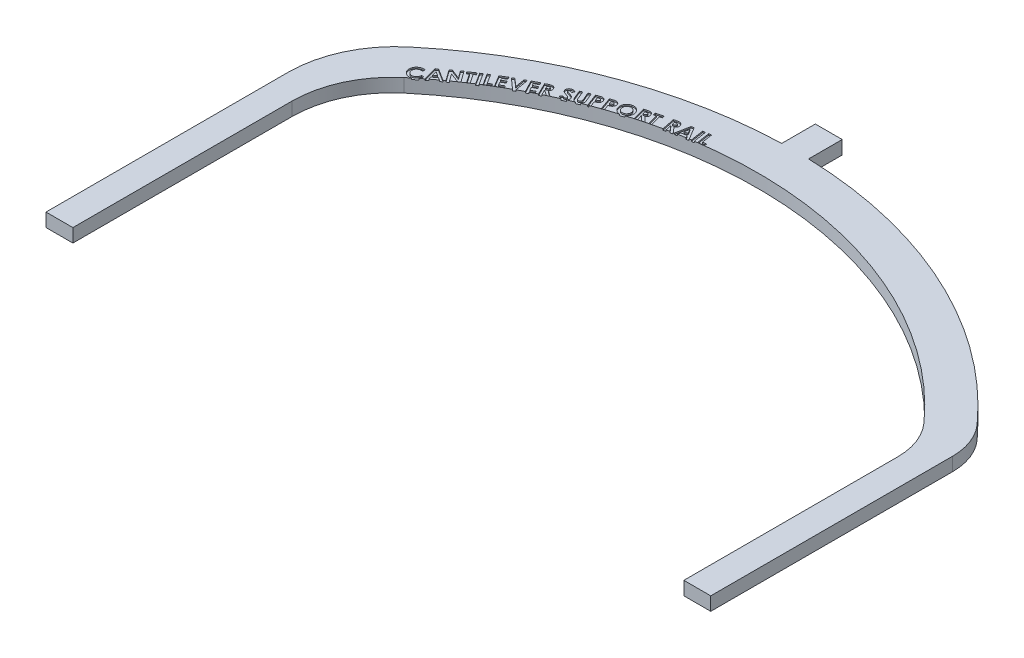
from build123d import *

# Parameters (mm, degrees)
BOSS_EXTRUDE1_DEPTH = 12.7
CUT_EXTRUDE1_DEPTH  = 1.27


with BuildPart() as part:
    # Sketch1 → Boss-Extrude1 (new body)
    with BuildSketch(Plane(origin=(0, 0, 0), x_dir=(1, 0, 0), z_dir=(0, 1, 0))):
        with BuildLine():
            Line((1550.835064837, 541.399098074), (1550.835064837, 573.149098074))
            Line((1550.835064837, 573.149098074), (1576.235064837, 573.149098074))
            Line((1576.235064837, 573.149098074), (1576.235064837, 541.399098074))
            ThreePointArc((1576.235064837, 541.399098074), (1738.74727729, 502.951930692), (1873.099473338, 403.765786028))
            ThreePointArc((1873.099473338, 403.765786028), (1883.76055811, 386.368476855), (1887.478900163, 366.306098448))
            Line((1887.478900163, 366.306098448), (1887.478900163, 137.706098448))
            Line((1887.478900163, 137.706098448), (1862.078900163, 137.706098448))
            Line((1862.078900163, 137.706098448), (1862.078900163, 339.83839355))
            ThreePointArc((1862.078900163, 339.83839355), (1858.095187718, 361.332582469), (1846.673243344, 379.971501666))
            ThreePointArc((1846.673243344, 379.971501666), (1590.112281333, 505.104643792), (1318.632985546, 416.895673471))
            ThreePointArc((1318.632985546, 416.895673471), (1293.734950284, 384.447922183), (1284.88267929, 344.517908135))
            Line((1284.88267929, 344.517908135), (1284.88267929, 137.706098448))
            Line((1284.88267929, 137.706098448), (1259.48267929, 137.706098448))
            Line((1259.48267929, 137.706098448), (1259.48267929, 366.306098448))
            ThreePointArc((1259.48267929, 366.306098448), (1269.001808127, 409.244113841), (1295.775458146, 444.136213869))
            ThreePointArc((1295.775458146, 444.136213869), (1415.111970585, 514.253524637), (1550.835064837, 541.399098074))
        make_face()
    extrude(amount=BOSS_EXTRUDE1_DEPTH)

    # Sketch2 → Cut-Extrude1 (cut)
    # profile 1 of 21: a face of its own
    with BuildSketch(Plane(origin=(0, 12.7, 0), x_dir=(1, 0, 0), z_dir=(0, 1, 0))):
        with BuildLine():
            Line((1322.301535226, 433.121755202), (1321.993702694, 430.824459529))
            add(Edge.make_bspline(
                [(1321.993702694, 430.824459529), (1321.792990552, 430.847773678), (1321.400083745, 430.89341261), (1320.818242651, 430.89612055), (1320.260830167, 430.85292004), (1319.728977648, 430.75277216), (1319.220926124, 430.602735401), (1318.738092919, 430.397836404), (1318.278760454, 430.141180913), (1317.998141673, 429.930547954), (1317.85704404, 429.824639817)],
                knots=[0, 0, 0, 0, 1.106407058, 2.165862322, 3.182258357, 4.165583983, 5.125578408, 6.079209504, 7.034209356, 8, 8, 8, 8], degree=3))
            add(Edge.make_bspline(
                [(1317.85704404, 429.824639817), (1317.743965978, 429.73013211), (1317.521269325, 429.544008031), (1317.22562581, 429.230941539), (1316.967177613, 428.899637239), (1316.747949915, 428.548562256), (1316.561652543, 428.181190217), (1316.421154369, 427.79163944), (1316.311699497, 427.385311391), (1316.248598124, 426.963675802), (1316.219620434, 426.53815035), (1316.231038252, 426.117745058), (1316.288480849, 425.707072825), (1316.384512632, 425.30699407), (1316.523996334, 424.917049487), (1316.702303909, 424.53769249), (1316.922351978, 424.167215228), (1317.098240031, 423.936015219), (1317.187953495, 423.818089337)],
                knots=[0, 0, 0, 0, 1.048666614, 2.065250675, 3.059364313, 4.036160022, 5.008371787, 5.98656645, 6.979652465, 8.000264036, 9.016937772, 10.013780458, 10.989063043, 11.964513869, 12.938599237, 13.932712874, 14.945559482, 16, 16, 16, 16], degree=3))
            add(Edge.make_bspline(
                [(1317.187953495, 423.818089337), (1317.254016311, 423.738411227), (1317.384411131, 423.581142534), (1317.59375497, 423.362162999), (1317.811139712, 423.160947684), (1318.03349619, 422.974035635), (1318.267425532, 422.809344142), (1318.505619735, 422.656678565), (1318.756222211, 422.529359375), (1319.093110179, 422.375164028), (1319.531239611, 422.233904656), (1320.072338879, 422.139671168), (1320.624759231, 422.117339598), (1321.087541622, 422.169874975), (1321.457760247, 422.241904894), (1321.731457088, 422.319745658), (1322.00168896, 422.410750337), (1322.264150722, 422.523536789), (1322.523789793, 422.650156048), (1322.774192954, 422.799584807), (1323.023609765, 422.961156277), (1323.180970134, 423.084167693), (1323.260649809, 423.146454721)],
                knots=[0, 0, 0, 0, 0.906768496, 1.789780124, 2.652099966, 3.501743399, 4.332757296, 5.157467836, 5.978420216, 6.793296384, 8.403019627, 9.994891478, 11.593668778, 13.230014881, 14.063616269, 14.896554964, 15.721399407, 16.560546755, 17.39801439, 18.250642224, 19.114209881, 20, 20, 20, 20], degree=3))
            add(Edge.make_bspline(
                [(1323.260649809, 423.146454721), (1323.391302282, 423.256467327), (1323.64831446, 423.472877921), (1323.983203759, 423.83995676), (1324.274887798, 424.225912791), (1324.476940142, 424.571961286), (1324.615379816, 424.866843243), (1324.7123665, 425.105999767), (1324.798901797, 425.365376864), (1324.876325897, 425.64335919), (1324.948064336, 425.940255584), (1325.011621046, 426.254967983), (1325.064720917, 426.589516435), (1325.093077551, 426.819151174), (1325.107645001, 426.937119785)],
                knots=[0, 0, 0, 0, 1.413778581, 2.781105497, 4.106207901, 5.416079275, 6.091817327, 6.804184776, 7.552939064, 8.355902415, 9.194324103, 10.083077087, 11.015232911, 12, 12, 12, 12], degree=3))
            Line((1325.107645001, 426.937119785), (1327.43292545, 426.629287253))
            add(Edge.make_bspline(
                [(1327.43292545, 426.629287253), (1327.4119425, 426.472247341), (1327.370776739, 426.164155898), (1327.292382647, 425.715092515), (1327.199755711, 425.289536077), (1327.100139388, 424.886155993), (1326.982018182, 424.508301835), (1326.855716246, 424.151507992), (1326.713292463, 423.819956148), (1326.559414883, 423.507852892), (1326.388996585, 423.211636895), (1326.200447374, 422.923650613), (1325.99175344, 422.642833769), (1325.766934623, 422.366085286), (1325.522964313, 422.096256208), (1325.257018363, 421.835007883), (1324.974975982, 421.57714899), (1324.77595698, 421.413086646), (1324.675153014, 421.329988375)],
                knots=[0, 0, 0, 0, 1.235167176, 2.423233892, 3.552734985, 4.63032496, 5.661332412, 6.637994054, 7.579932953, 8.47289115, 9.349545907, 10.242602006, 11.155027255, 12.076106929, 13.021635592, 13.989394599, 14.98161987, 16, 16, 16, 16], degree=3))
            add(Edge.make_bspline(
                [(1324.675153014, 421.329988375), (1324.485168047, 421.184766882), (1324.112734762, 420.900084791), (1323.520200914, 420.541177739), (1322.920338532, 420.243530355), (1322.307334411, 420.015015992), (1321.684872862, 419.853924449), (1321.051305625, 419.75989097), (1320.407694973, 419.727977685), (1319.759101268, 419.767884232), (1319.118255184, 419.868503754), (1318.496044857, 420.030977002), (1317.90055608, 420.259460318), (1317.329487054, 420.548123723), (1316.785597248, 420.90181203), (1316.267956346, 421.317844984), (1315.770019137, 421.790328458), (1315.472319067, 422.14769013), (1315.320605739, 422.329808087)],
                knots=[0, 0, 0, 0, 1.086674333, 2.130240604, 3.14425077, 4.127665887, 5.099392052, 6.062457184, 7.035276795, 8.024112503, 9.011804752, 9.980772719, 10.942540086, 11.906531123, 12.885179544, 13.886655603, 14.923001557, 16, 16, 16, 16], degree=3))
            add(Edge.make_bspline(
                [(1315.320605739, 422.329808087), (1315.225920886, 422.452584773), (1315.039007108, 422.694953575), (1314.786137542, 423.072308549), (1314.565362348, 423.457414315), (1314.369864368, 423.847114719), (1314.20782429, 424.244957192), (1314.072030175, 424.648383185), (1313.964508501, 425.057894762), (1313.889000669, 425.473920106), (1313.83966441, 425.892833938), (1313.823016685, 426.31368732), (1313.83173687, 426.734575266), (1313.874883759, 427.154855224), (1313.938884646, 427.577168728), (1314.039649043, 427.998212284), (1314.168141016, 428.420010735), (1314.32084443, 428.839994198), (1314.505283944, 429.249626179), (1314.706951352, 429.648451525), (1314.937939382, 430.027845739), (1315.189378518, 430.392080425), (1315.464587183, 430.739808656), (1315.765909552, 431.066607237), (1316.08696256, 431.380469514), (1316.318194013, 431.572276114), (1316.434908623, 431.669090939)],
                knots=[0, 0, 0, 0, 1.063446131, 2.099308708, 3.113128256, 4.106972012, 5.08791094, 6.057415066, 7.025382015, 7.989565502, 8.955800203, 9.916555268, 10.876728927, 11.841122996, 12.812858676, 13.804861852, 14.807857841, 15.836704875, 16.868032467, 17.887942674, 18.900609878, 19.912424507, 20.922732836, 21.939801947, 22.960110272, 24, 24, 24, 24], degree=3))
            add(Edge.make_bspline(
                [(1316.434908623, 431.669090939), (1316.536608211, 431.748346862), (1316.739998582, 431.906851845), (1317.060241976, 432.121498196), (1317.391001963, 432.318536745), (1317.730018456, 432.49908371), (1318.080445135, 432.659248622), (1318.439660963, 432.803545748), (1318.81138064, 432.923082009), (1319.189166501, 433.031205195), (1319.572927533, 433.11792965), (1319.960464658, 433.180960431), (1320.348533035, 433.224237948), (1320.737431431, 433.247115863), (1321.12730916, 433.250595948), (1321.518678922, 433.228798006), (1321.911445352, 433.190145854), (1322.171174641, 433.144610052), (1322.301535226, 433.121755202)],
                knots=[0, 0, 0, 0, 0.992690894, 1.985295856, 2.966426479, 3.956794582, 4.941569963, 5.932368623, 6.936061861, 7.947058632, 8.957886643, 9.963893104, 10.969242217, 11.9636502, 12.962871673, 13.969958643, 14.981103055, 16, 16, 16, 16], degree=3))
        make_face()
    # profile 2 of 21: a face of its own
    with BuildSketch(Plane(origin=(0, 12.7, 0), x_dir=(1, 0, 0), z_dir=(0, 1, 0))):
        Polygon((1325.925495015, 438.718814565), (1327.866620817, 440.176566969), (1339.289497419, 433.025184757), (1337.300034278, 431.531815366), (1334.959489406, 433.012464405), (1330.855903669, 429.929050943), (1331.591140047, 427.242512482), (1329.601676906, 425.749143091), align=None)
        Polygon((1328.912233797, 436.790409116), (1330.16391649, 432.333197578), (1332.837734599, 434.340469212), align=None, mode=Mode.SUBTRACT)
    # profile 3 of 21: a face of its own
    with BuildSketch(Plane(origin=(0, 12.7, 0), x_dir=(1, 0, 0), z_dir=(0, 1, 0))):
        Polygon((1333.488387798, 444.467269589), (1335.363367766, 445.81053882), (1344.626328503, 442.197958691), (1339.777330106, 448.970274397), (1341.736264401, 450.372057249), (1349.103892606, 440.081292025), (1347.221280427, 438.732934653), (1337.981216324, 442.330250358), (1342.814950298, 435.578287217), (1340.856016003, 434.176504364), align=None)
    # profile 4 of 21: a face of its own
    with BuildSketch(Plane(origin=(0, 12.7, 0), x_dir=(1, 0, 0), z_dir=(0, 1, 0))):
        Polygon((1343.457262938, 451.318057438), (1349.209406368, 455.213029394), (1350.532323034, 453.26172731), (1348.636990502, 451.979515772), (1354.361149156, 443.523025387), (1352.351333451, 442.161947663), (1346.627174797, 450.618438047), (1344.780179605, 449.366755355), align=None)
    # profile 5 of 21: a face of its own
    with BuildSketch(Plane(origin=(0, 12.7, 0), x_dir=(1, 0, 0), z_dir=(0, 1, 0))):
        Polygon((1350.746765292, 456.165820244), (1352.756580997, 457.445487712), (1359.533984843, 446.803640757), (1357.524169138, 445.523973289), align=None)
    # profile 6 of 21: a face of its own
    with BuildSketch(Plane(origin=(0, 12.7, 0), x_dir=(1, 0, 0), z_dir=(0, 1, 0))):
        Polygon((1355.00829609, 458.885628585), (1357.033376218, 460.175472335), (1362.581994006, 451.464574899), (1365.533115801, 453.344643008), (1366.761901859, 451.413693489), (1361.785699936, 448.24378163), align=None)
    # profile 7 of 21: a face of its own
    with BuildSketch(Plane(origin=(0, 12.7, 0), x_dir=(1, 0, 0), z_dir=(0, 1, 0))):
        Polygon((1361.97326443, 463.070415371), (1367.847523244, 466.614305596), (1369.055956737, 464.609578031), (1365.214410263, 462.291929794), (1366.387226769, 460.348259922), (1370.228773244, 462.66590816), (1371.416854173, 460.696797583), (1367.575307699, 458.379149346), (1369.282379013, 455.550142935), (1373.123925487, 457.867791172), (1374.337447122, 455.855431397), (1368.463188308, 452.311541172), align=None)
    # profile 8 of 21: a face of its own
    with BuildSketch(Plane(origin=(0, 12.7, 0), x_dir=(1, 0, 0), z_dir=(0, 1, 0))):
        Polygon((1369.422659541, 467.394152944), (1371.574943195, 468.587322014), (1378.667811785, 462.308555989), (1377.141369477, 471.673279547), (1379.293653131, 472.866448617), (1381.425584221, 459.677987079), (1379.408136304, 458.558596053), align=None)
    # profile 9 of 21: a face of its own
    with BuildSketch(Plane(origin=(0, 12.7, 0), x_dir=(1, 0, 0), z_dir=(0, 1, 0))):
        Polygon((1381.397188685, 474.012984956), (1387.52585455, 477.200705308), (1388.612172659, 475.109479347), (1384.605261602, 473.025885597), (1385.663594935, 470.995717327), (1389.670505993, 473.079311077), (1390.739015608, 471.026246174), (1386.73210455, 468.942652424), (1388.26872314, 465.988986558), (1392.275634198, 468.072580308), (1393.367040448, 465.973722135), (1387.238374582, 462.786001783), align=None)
    # profile 10 of 21: a face of its own
    with BuildSketch(Plane(origin=(0, 12.7, 0), x_dir=(1, 0, 0), z_dir=(0, 1, 0))):
        with BuildLine():
            Line((1389.975096134, 478.316308835), (1392.264759595, 479.43315579))
            add(Edge.make_bspline(
                [(1392.264759595, 479.43315579), (1392.416136279, 479.50613655), (1392.707750929, 479.646727944), (1393.135338161, 479.835183399), (1393.535165892, 479.995962821), (1393.90606974, 480.130496821), (1394.246093579, 480.242459532), (1394.55916782, 480.321770213), (1394.842884963, 480.376131013), (1395.181650108, 480.415038813), (1395.584294484, 480.404175002), (1396.053607439, 480.32071452), (1396.50874792, 480.15664168), (1396.870215565, 479.961127893), (1397.149553623, 479.773955618), (1397.350120752, 479.613701171), (1397.538923183, 479.436857837), (1397.718194656, 479.245400818), (1397.886158107, 479.035931887), (1398.043519434, 478.809933535), (1398.189034294, 478.567298135), (1398.275689208, 478.397404264), (1398.319647416, 478.311220694)],
                knots=[0, 0, 0, 0, 1.422593538, 2.740508689, 3.954993647, 5.070073994, 6.080396258, 6.984084481, 7.802160152, 8.524404601, 9.867211116, 11.195119397, 12.543919373, 13.944275246, 14.663086207, 15.388499269, 16.114870863, 16.851389181, 17.607076929, 18.385773865, 19.181137187, 20, 20, 20, 20], degree=3))
            add(Edge.make_bspline(
                [(1398.319647416, 478.311220694), (1398.362326146, 478.219274653), (1398.446259846, 478.038449888), (1398.550811757, 477.763337406), (1398.632858822, 477.49050153), (1398.691543291, 477.220841059), (1398.727768408, 476.954585959), (1398.740868362, 476.691532431), (1398.729956467, 476.432058223), (1398.700125718, 476.175682817), (1398.645995989, 475.922920362), (1398.570079172, 475.673213131), (1398.468874489, 475.428384728), (1398.350036122, 475.184505801), (1398.203037944, 474.946613579), (1398.037759866, 474.70801277), (1397.847050879, 474.47503157), (1397.706603269, 474.326367036), (1397.635292448, 474.250884155)],
                knots=[0, 0, 0, 0, 1.096487852, 2.156396899, 3.181092263, 4.176280596, 5.139094629, 6.085239497, 7.02181581, 7.945905086, 8.874447392, 9.814791195, 10.765507159, 11.737977847, 12.746609604, 13.787646357, 14.876700308, 16, 16, 16, 16], degree=3))
            Line((1397.635292448, 474.250884155), (1402.779403025, 470.518732713))
            Line((1402.779403025, 470.518732713), (1400.421049659, 469.366268771))
            Line((1400.421049659, 469.366268771), (1395.523713922, 472.925423418))
            Line((1395.523713922, 472.925423418), (1395.325276422, 472.828748739))
            Line((1395.325276422, 472.828748739), (1397.668365364, 468.02554361))
            Line((1397.668365364, 468.02554361), (1395.508449499, 466.972298418))
            Line((1395.508449499, 466.972298418), (1389.975096134, 478.316308835))
        make_face()
        with BuildLine():
            Line((1394.297471935, 474.935239123), (1394.974194691, 475.263424219))
            add(Edge.make_bspline(
                [(1394.974194691, 475.263424219), (1395.056843812, 475.304215218), (1395.215431232, 475.382485129), (1395.437849655, 475.507467316), (1395.634903077, 475.632903093), (1395.812201214, 475.749819839), (1395.9611732, 475.870945586), (1396.085993831, 475.990303931), (1396.189241695, 476.106513323), (1396.292483703, 476.259555675), (1396.372367914, 476.467149427), (1396.398694085, 476.737934328), (1396.345046167, 477.027256363), (1396.263893793, 477.214493153), (1396.220789243, 477.313945053)],
                knots=[0, 0, 0, 0, 1.200426863, 2.303383239, 3.320888538, 4.243092844, 5.067715529, 5.817715453, 6.491077461, 7.088489117, 8.214654342, 9.346763004, 10.590717892, 12, 12, 12, 12], degree=3))
            add(Edge.make_bspline(
                [(1396.220789243, 477.313945053), (1396.189499441, 477.372723006), (1396.128661363, 477.487007453), (1396.00881988, 477.637315544), (1395.870136406, 477.763015427), (1395.715152322, 477.864400354), (1395.548685201, 477.940772383), (1395.374294633, 477.994127256), (1395.19089965, 478.012162493), (1395.032771587, 478.009269053), (1394.896095713, 477.988519936), (1394.778426524, 477.959514699), (1394.644297171, 477.922132619), (1394.497218416, 477.86611044), (1394.333057476, 477.803820913), (1394.15327044, 477.730019377), (1393.961183247, 477.639722119), (1393.82763295, 477.576048988), (1393.758128986, 477.542911399)],
                knots=[0, 0, 0, 0, 1.12930227, 2.195749908, 3.246217328, 4.29707981, 5.328406346, 6.349519975, 7.378832199, 8.445279837, 9.027974321, 9.723362363, 10.503028987, 11.39167048, 12.394945795, 13.486494279, 14.691889031, 16, 16, 16, 16], degree=3))
            Line((1393.758128986, 477.542911399), (1393.165360557, 477.255431431))
            Line((1393.165360557, 477.255431431), (1394.297471935, 474.935239123))
        make_face(mode=Mode.SUBTRACT)
    # profile 11 of 21: a face of its own
    with BuildSketch(Plane(origin=(0, 12.7, 0), x_dir=(1, 0, 0), z_dir=(0, 1, 0))):
        with BuildLine():
            Line((1410.994001857, 485.960754985), (1409.958565158, 483.816103543))
            add(Edge.make_bspline(
                [(1409.958565158, 483.816103543), (1409.847681443, 483.882479693), (1409.63520242, 484.009671856), (1409.311704032, 484.162643239), (1409.005098042, 484.280662367), (1408.712477188, 484.36333698), (1408.433369424, 484.40079929), (1408.168826617, 484.406200043), (1407.91827672, 484.368666312), (1407.763193326, 484.313810206), (1407.68671019, 484.286756588)],
                knots=[0, 0, 0, 0, 1.2878694, 2.467857736, 3.562383444, 4.561287718, 5.49159874, 6.362533299, 7.192443595, 8, 8, 8, 8], degree=3))
            add(Edge.make_bspline(
                [(1407.68671019, 484.286756588), (1407.617697362, 484.255007455), (1407.485090607, 484.194002139), (1407.310795865, 484.070080216), (1407.171160761, 483.922365207), (1407.064886001, 483.758110078), (1406.994145851, 483.587767986), (1406.958238484, 483.41952022), (1406.960804494, 483.256024813), (1406.995440537, 483.155775399), (1407.012531504, 483.10630787)],
                knots=[0, 0, 0, 0, 1.210634971, 2.326210629, 3.388969557, 4.436448685, 5.431823306, 6.315773386, 7.168927529, 8, 8, 8, 8], degree=3))
            add(Edge.make_bspline(
                [(1407.012531504, 483.10630787), (1407.035401652, 483.058618854), (1407.081079748, 482.963370523), (1407.181740174, 482.837781219), (1407.301354726, 482.723600212), (1407.396344102, 482.663771361), (1407.445023491, 482.633110754)],
                knots=[0, 0, 0, 0, 0.970598421, 1.938557122, 2.943568372, 4, 4, 4, 4], degree=3))
            add(Edge.make_bspline(
                [(1407.445023491, 482.633110754), (1407.48727271, 482.611602545), (1407.585003374, 482.561849871), (1407.755805956, 482.485435358), (1407.9729697, 482.403972215), (1408.232969216, 482.306378277), (1408.537362954, 482.197584542), (1408.886712229, 482.077819868), (1409.280421805, 481.948677464), (1409.558224138, 481.860330244), (1409.704158107, 481.813920049)],
                knots=[0, 0, 0, 0, 0.473039196, 1.094231703, 1.86580489, 2.786879137, 3.865541278, 5.091156532, 6.471938417, 8, 8, 8, 8], degree=3))
            add(Edge.make_bspline(
                [(1409.704158107, 481.813920049), (1409.840697651, 481.77154339), (1410.099426851, 481.69124373), (1410.466894638, 481.576783705), (1410.79197947, 481.473320791), (1411.074680341, 481.378381544), (1411.316345248, 481.296898495), (1411.51716131, 481.229326336), (1411.676077159, 481.171397082), (1411.766661316, 481.133233218), (1411.80556035, 481.116844729)],
                knots=[0, 0, 0, 0, 1.549332474, 2.935834844, 4.171053748, 5.246346381, 6.167615194, 6.934873036, 7.542608647, 8, 8, 8, 8], degree=3))
            add(Edge.make_bspline(
                [(1411.80556035, 481.116844729), (1411.95828367, 481.049279853), (1412.251225888, 480.919682064), (1412.658092476, 480.701826883), (1413.011245548, 480.468076978), (1413.315265549, 480.21764167), (1413.577501414, 479.944741982), (1413.806505555, 479.64596553), (1414.007599364, 479.319016517), (1414.113044456, 479.083740439), (1414.166457786, 478.964561075)],
                knots=[0, 0, 0, 0, 1.218593649, 2.33741335, 3.36393597, 4.304581952, 5.206304846, 6.119908159, 7.047637353, 8, 8, 8, 8], degree=3))
            add(Edge.make_bspline(
                [(1414.166457786, 478.964561075), (1414.212951264, 478.845811761), (1414.304244004, 478.612640344), (1414.398139737, 478.254225807), (1414.454020013, 477.898820437), (1414.476659788, 477.545818449), (1414.454441213, 477.19615438), (1414.398594591, 476.848993275), (1414.303641348, 476.504514118), (1414.171367845, 476.16578431), (1414.007460446, 475.838683183), (1413.810067237, 475.530464933), (1413.579442767, 475.245103985), (1413.319501011, 474.979210158), (1413.026810445, 474.737144439), (1412.705025746, 474.514454876), (1412.349940462, 474.315790528), (1412.097388068, 474.203467604), (1411.968380863, 474.146091524)],
                knots=[0, 0, 0, 0, 1.029556458, 2.021595992, 2.985708114, 3.932703223, 4.872859116, 5.809914817, 6.768877421, 7.753580461, 8.74318054, 9.719963619, 10.704285286, 11.702244539, 12.718864513, 13.767839756, 14.859782129, 16, 16, 16, 16], degree=3))
            add(Edge.make_bspline(
                [(1411.968380863, 474.146091524), (1411.865517533, 474.104559295), (1411.663102866, 474.022832092), (1411.352528068, 473.93044914), (1411.045713596, 473.854605592), (1410.739190382, 473.806922159), (1410.435722129, 473.781299803), (1410.134467212, 473.777441713), (1409.835407098, 473.802608993), (1409.537214746, 473.843872637), (1409.239679857, 473.914272434), (1408.942035115, 474.008527317), (1408.642279374, 474.128533349), (1408.344357676, 474.277915107), (1408.041420969, 474.444768774), (1407.742012683, 474.642427305), (1407.440579495, 474.864142944), (1407.244912493, 475.026992167), (1407.144823171, 475.110294248)],
                knots=[0, 0, 0, 0, 1.019512359, 2.006198468, 2.976478022, 3.923895165, 4.855128123, 5.775325414, 6.690386988, 7.612333799, 8.54108207, 9.49798304, 10.481211848, 11.506523105, 12.560840675, 13.65958443, 14.802809837, 16, 16, 16, 16], degree=3))
            Line((1407.144823171, 475.110294248), (1408.544061953, 477.020891203))
            add(Edge.make_bspline(
                [(1408.544061953, 477.020891203), (1408.664684827, 476.928038939), (1408.895562706, 476.750315318), (1409.250732163, 476.528419247), (1409.592359417, 476.353108528), (1409.924898528, 476.236863821), (1410.244076527, 476.161536896), (1410.552855585, 476.151553256), (1410.851558008, 476.182206192), (1411.036521715, 476.249516167), (1411.128837594, 476.283110754)],
                knots=[0, 0, 0, 0, 1.293695427, 2.476194169, 3.556545698, 4.550954296, 5.466090318, 6.332180663, 7.167586921, 8, 8, 8, 8], degree=3))
            add(Edge.make_bspline(
                [(1411.128837594, 476.283110754), (1411.219765858, 476.324749444), (1411.395733035, 476.40532992), (1411.623655781, 476.578695982), (1411.812661421, 476.781232008), (1411.955290506, 477.012273688), (1412.056299701, 477.252587997), (1412.101156691, 477.495300901), (1412.094361885, 477.732631362), (1412.044243305, 477.879043541), (1412.019262273, 477.952021011)],
                knots=[0, 0, 0, 0, 1.144243178, 2.214374637, 3.260806911, 4.305428748, 5.313487681, 6.233226722, 7.11937213, 8, 8, 8, 8], degree=3))
            add(Edge.make_bspline(
                [(1412.019262273, 477.952021011), (1411.987758924, 478.017104338), (1411.923552018, 478.149750525), (1411.778340184, 478.325518028), (1411.600906722, 478.487077051), (1411.423735123, 478.606989991), (1411.255775099, 478.700962812), (1411.099073476, 478.775633998), (1410.915051499, 478.854892375), (1410.703073466, 478.935337628), (1410.463870612, 479.021747942), (1410.197041421, 479.113530909), (1409.901795228, 479.207474412), (1409.69494839, 479.268545492), (1409.587130863, 479.300378383)],
                knots=[0, 0, 0, 0, 0.905725074, 1.845956287, 2.841555597, 3.914441672, 4.525072941, 5.25899477, 6.094286937, 7.042155343, 8.107287944, 9.290058335, 10.587461091, 12, 12, 12, 12], degree=3))
            add(Edge.make_bspline(
                [(1409.587130863, 479.300378383), (1409.382616061, 479.362673654), (1408.989794935, 479.48232709), (1408.426560424, 479.661878023), (1407.914689273, 479.83916737), (1407.455647097, 480.015019005), (1407.046107633, 480.181364283), (1406.689830571, 480.346659653), (1406.383376507, 480.505789643), (1406.122686647, 480.663105882), (1405.898915968, 480.825170485), (1405.69819454, 480.991602456), (1405.51091523, 481.160264935), (1405.345318568, 481.340681905), (1405.194264022, 481.525746485), (1405.06177279, 481.719883137), (1404.946437833, 481.920528098), (1404.883722024, 482.060139164), (1404.852615639, 482.129384793)],
                knots=[0, 0, 0, 0, 1.800633136, 3.458560108, 4.978748589, 6.362272065, 7.598462714, 8.700915496, 9.668939887, 10.505575651, 11.26280371, 11.993494963, 12.701204515, 13.383480334, 14.053876462, 14.7115971, 15.360965638, 16, 16, 16, 16], degree=3))
            add(Edge.make_bspline(
                [(1404.852615639, 482.129384793), (1404.81429023, 482.230515557), (1404.738701358, 482.429974889), (1404.658637495, 482.737334289), (1404.615789891, 483.046406382), (1404.605570701, 483.356765091), (1404.627844582, 483.669230692), (1404.688703705, 483.982182064), (1404.776614583, 484.297522459), (1404.902982488, 484.607815964), (1405.052340642, 484.910678892), (1405.231192743, 485.194776099), (1405.436606798, 485.454906925), (1405.664033087, 485.696873181), (1405.918974, 485.91487465), (1406.197615625, 486.111245055), (1406.500374954, 486.286874039), (1406.716428811, 486.382533834), (1406.826814357, 486.43140803)],
                knots=[0, 0, 0, 0, 0.984956985, 1.942622148, 2.886756607, 3.822219336, 4.767459802, 5.734338717, 6.722472941, 7.745518332, 8.782187537, 9.796176267, 10.797813089, 11.798048164, 12.817175954, 13.848359334, 14.900690636, 16, 16, 16, 16], degree=3))
            add(Edge.make_bspline(
                [(1406.826814357, 486.43140803), (1406.973233198, 486.486677453), (1407.264527366, 486.596633662), (1407.722037133, 486.698587926), (1408.189499753, 486.740210414), (1408.586710875, 486.732284364), (1408.913513151, 486.696018349), (1409.173133966, 486.64615864), (1409.445589199, 486.579660957), (1409.731182091, 486.495745431), (1410.029658341, 486.390281181), (1410.340805451, 486.265671286), (1410.665441733, 486.123260676), (1410.882480277, 486.015913509), (1410.994001857, 485.960754985)],
                knots=[0, 0, 0, 0, 1.296358908, 2.57905188, 3.871228635, 5.179260446, 5.865619567, 6.595097192, 7.369284117, 8.190203814, 9.061853328, 9.99273808, 10.968602458, 12, 12, 12, 12], degree=3))
        make_face()
    # profile 12 of 21: a face of its own
    with BuildSketch(Plane(origin=(0, 12.7, 0), x_dir=(1, 0, 0), z_dir=(0, 1, 0))):
        with BuildLine():
            Line((1412.48438497, 488.58123768), (1414.71807888, 489.514911558))
            Line((1414.71807888, 489.514911558), (1417.885446669, 481.946301783))
            add(Edge.make_bspline(
                [(1417.885446669, 481.946301783), (1417.918920206, 481.868082428), (1417.98329556, 481.717653193), (1418.0834955, 481.503499819), (1418.178169761, 481.308150893), (1418.274149968, 481.134371248), (1418.362867261, 480.978277009), (1418.456874424, 480.846795398), (1418.541505633, 480.730053542), (1418.656195598, 480.605778297), (1418.810070041, 480.479751501), (1419.010395191, 480.356965678), (1419.233001951, 480.271328125), (1419.471587297, 480.213905323), (1419.724863066, 480.198221366), (1419.986273081, 480.214992288), (1420.254903012, 480.275601123), (1420.430260269, 480.342139969), (1420.52110372, 480.376610276)],
                knots=[0, 0, 0, 0, 1.153241552, 2.217881292, 3.204972048, 4.094904629, 4.909153226, 5.636204372, 6.284565251, 6.862216424, 7.923437174, 8.970302464, 10.03338948, 11.14318489, 12.284099347, 13.459417498, 14.683856679, 16, 16, 16, 16], degree=3))
            add(Edge.make_bspline(
                [(1420.52110372, 480.376610276), (1420.614925814, 480.418951336), (1420.798061154, 480.501598654), (1421.042435076, 480.665824704), (1421.25305997, 480.853815766), (1421.424698718, 481.065619744), (1421.564204876, 481.290328274), (1421.657002043, 481.526300246), (1421.717347458, 481.764840115), (1421.726585726, 481.971111685), (1421.713121317, 482.147222058), (1421.686311875, 482.301006775), (1421.64411847, 482.476151516), (1421.592303933, 482.674874686), (1421.518578769, 482.892508719), (1421.435686063, 483.133548607), (1421.332727466, 483.393747691), (1421.259047724, 483.574578263), (1421.220723111, 483.66863752)],
                knots=[0, 0, 0, 0, 1.266784692, 2.47269099, 3.612370752, 4.73383688, 5.821880848, 6.858298803, 7.846976863, 8.841274022, 9.386374246, 10.022133618, 10.762444203, 11.606715777, 12.552013388, 13.593268548, 14.748135506, 16, 16, 16, 16], degree=3))
            Line((1421.220723111, 483.66863752), (1418.167838496, 490.959943609))
            Line((1418.167838496, 490.959943609), (1420.401532406, 491.893617488))
            Line((1420.401532406, 491.893617488), (1423.319581284, 484.920320212))
            add(Edge.make_bspline(
                [(1423.319581284, 484.920320212), (1423.378904684, 484.779024113), (1423.492795775, 484.507759029), (1423.643865748, 484.112084683), (1423.780507912, 483.750312196), (1423.891887736, 483.417016017), (1423.987922494, 483.116843844), (1424.05759356, 482.846138463), (1424.114958385, 482.608660474), (1424.154289101, 482.330098474), (1424.172868801, 481.995221016), (1424.14199582, 481.590037356), (1424.068812425, 481.170830534), (1423.943185264, 480.747474971), (1423.781972933, 480.331781663), (1423.577860938, 479.941484735), (1423.331036727, 479.585788333), (1423.046840081, 479.259803381), (1422.718984433, 478.963418147), (1422.345141956, 478.697996607), (1421.92807774, 478.452843574), (1421.625877291, 478.318858973), (1421.470042021, 478.249767327)],
                knots=[0, 0, 0, 0, 1.154357555, 2.216175107, 3.190457693, 4.067242665, 4.863373573, 5.5637814, 6.172870319, 6.702306844, 7.681082269, 8.692908209, 9.756876047, 10.880997562, 12.013943226, 13.111278163, 14.190480593, 15.268036698, 16.362578625, 17.511460767, 18.71673856, 20, 20, 20, 20], degree=3))
            add(Edge.make_bspline(
                [(1421.470042021, 478.249767327), (1421.36542475, 478.207587981), (1421.15853305, 478.124173869), (1420.843470788, 478.026466854), (1420.531092151, 477.948636721), (1420.221525807, 477.895255996), (1419.914596293, 477.865373488), (1419.610214128, 477.853074069), (1419.308422607, 477.870206252), (1419.010766285, 477.904732199), (1418.722297504, 477.961730519), (1418.443858303, 478.031827526), (1418.179596046, 478.12095863), (1417.928432214, 478.226493542), (1417.688478399, 478.345227554), (1417.46223472, 478.482499472), (1417.250054886, 478.637246252), (1417.043707026, 478.807243234), (1416.843949657, 479.00993476), (1416.648614785, 479.256277026), (1416.445869898, 479.54160741), (1416.243470142, 479.8730247), (1416.033833199, 480.2434143), (1415.82796844, 480.661105665), (1415.609451612, 481.117011917), (1415.473141935, 481.440261006), (1415.402433848, 481.607940404)],
                knots=[0, 0, 0, 0, 1.018293376, 2.013782662, 2.975927212, 3.92397893, 4.847557232, 5.759408398, 6.671902528, 7.574314255, 8.463467738, 9.325323095, 10.165678633, 10.979225487, 11.784074931, 12.581309872, 13.36563988, 14.153997474, 14.993375366, 15.929881177, 16.990187904, 18.152659768, 19.435051747, 20.832411574, 22.356872952, 24, 24, 24, 24], degree=3))
            Line((1415.402433848, 481.607940404), (1412.48438497, 488.58123768))
        make_face()
    # profile 13 of 21: a face of its own
    with BuildSketch(Plane(origin=(0, 12.7, 0), x_dir=(1, 0, 0), z_dir=(0, 1, 0))):
        with BuildLine():
            Line((1423.372881719, 492.876702349), (1425.75921986, 493.790023664))
            add(Edge.make_bspline(
                [(1425.75921986, 493.790023664), (1425.914871558, 493.848763748), (1426.215304664, 493.962141669), (1426.65548329, 494.108566752), (1427.06573037, 494.234523009), (1427.445657259, 494.336537717), (1427.796770458, 494.415061813), (1428.118960572, 494.465725518), (1428.412000454, 494.494862987), (1428.679328856, 494.502082998), (1428.928185899, 494.481417665), (1429.168515982, 494.450431187), (1429.402283099, 494.396129426), (1429.630166792, 494.324508427), (1429.851462182, 494.235519661), (1430.067238587, 494.128273167), (1430.274602482, 493.999516427), (1430.479041569, 493.858784861), (1430.671599804, 493.697210881), (1430.856356602, 493.52223637), (1431.025992981, 493.327209663), (1431.186874254, 493.118988539), (1431.334695789, 492.894378373), (1431.468856627, 492.65382293), (1431.59552981, 492.399270755), (1431.666172866, 492.220060862), (1431.702168578, 492.128745619)],
                knots=[0, 0, 0, 0, 1.685466839, 3.253225273, 4.69921311, 6.033076036, 7.238094831, 8.34274807, 9.335357144, 10.220517108, 11.04755497, 11.862905841, 12.67371686, 13.475371053, 14.281112884, 15.088044949, 15.913250855, 16.752296914, 17.600487801, 18.45733834, 19.327865163, 20.216354999, 21.121922058, 22.049119932, 23.005941671, 24, 24, 24, 24], degree=3))
            add(Edge.make_bspline(
                [(1431.702168578, 492.128745619), (1431.739694824, 492.027587594), (1431.813517618, 491.828586395), (1431.889559054, 491.52530737), (1431.947788872, 491.229183811), (1431.978351585, 490.938032062), (1431.983821015, 490.651999677), (1431.963478715, 490.370961757), (1431.917630177, 490.094973572), (1431.845929787, 489.825324187), (1431.751713035, 489.563423912), (1431.637069479, 489.311921527), (1431.503780961, 489.069622361), (1431.34818218, 488.838634974), (1431.172111973, 488.616603278), (1430.975276829, 488.405243961), (1430.758922723, 488.203086523), (1430.601551617, 488.079978389), (1430.52171986, 488.01752767)],
                knots=[0, 0, 0, 0, 1.118195394, 2.199748614, 3.23817249, 4.246359182, 5.231573088, 6.201594864, 7.164573484, 8.128836504, 9.091413398, 10.047863274, 10.992676975, 11.956217731, 12.932835938, 13.928593038, 14.949209533, 16, 16, 16, 16], degree=3))
            add(Edge.make_bspline(
                [(1430.52171986, 488.01752767), (1430.467877164, 487.979565253), (1430.350902117, 487.89709064), (1430.151796393, 487.778542129), (1429.915946917, 487.655229786), (1429.647373283, 487.519599474), (1429.342158837, 487.380934815), (1429.00126379, 487.236071062), (1428.626478346, 487.080227656), (1428.36206929, 486.978880403), (1428.224424187, 486.92612142)],
                knots=[0, 0, 0, 0, 0.620038409, 1.347054058, 2.179206309, 3.12533192, 4.179171049, 5.334366645, 6.612334305, 8, 8, 8, 8], degree=3))
            Line((1428.224424187, 486.92612142), (1430.135021142, 481.924478792))
            Line((1430.135021142, 481.924478792), (1427.886062809, 481.064582958))
            Line((1427.886062809, 481.064582958), (1423.372881719, 492.876702349))
        make_face()
        with BuildLine():
            Line((1427.387424988, 489.119110202), (1428.102308802, 489.391325747))
            add(Edge.make_bspline(
                [(1428.102308802, 489.391325747), (1428.231791399, 489.442524998), (1428.469251411, 489.536420047), (1428.786226805, 489.683974102), (1429.035162606, 489.818129538), (1429.222025134, 489.949579136), (1429.358540092, 490.086233416), (1429.463695073, 490.229709175), (1429.545175469, 490.385410672), (1429.597428583, 490.554351035), (1429.626690306, 490.732602248), (1429.623185616, 490.918351922), (1429.589534408, 491.10864637), (1429.546563373, 491.232883854), (1429.524444219, 491.296834561)],
                knots=[0, 0, 0, 0, 1.835359118, 3.365891694, 4.607118792, 5.559818435, 6.366204397, 7.142176498, 7.89724755, 8.671607073, 9.463840012, 10.26890727, 11.108927524, 12, 12, 12, 12], degree=3))
            add(Edge.make_bspline(
                [(1429.524444219, 491.296834561), (1429.502178443, 491.351840165), (1429.459194979, 491.45802696), (1429.372225526, 491.601230987), (1429.280128683, 491.73041904), (1429.170326823, 491.838353267), (1429.050555297, 491.930975913), (1428.917236846, 492.005834194), (1428.77054245, 492.058657221), (1428.668226704, 492.081510432), (1428.616211046, 492.093128632)],
                knots=[0, 0, 0, 0, 1.120489056, 2.163073078, 3.160766418, 4.11347921, 5.063081425, 6.018086827, 6.992427632, 8, 8, 8, 8], degree=3))
            add(Edge.make_bspline(
                [(1428.616211046, 492.093128632), (1428.573875714, 492.098168774), (1428.483517619, 492.108926163), (1428.337477677, 492.108644589), (1428.17463518, 492.088041742), (1427.993037314, 492.059158079), (1427.79463967, 492.007446903), (1427.57616048, 491.948963092), (1427.342397967, 491.867548655), (1427.181258368, 491.808429587), (1427.09740095, 491.777663888)],
                knots=[0, 0, 0, 0, 0.652982017, 1.393687203, 2.230315977, 3.166033818, 4.209268437, 5.369525377, 6.631094959, 8, 8, 8, 8], degree=3))
            Line((1427.09740095, 491.777663888), (1426.463927392, 491.535977189))
            Line((1426.463927392, 491.535977189), (1427.387424988, 489.119110202))
        make_face(mode=Mode.SUBTRACT)
    # profile 14 of 21: a face of its own
    with BuildSketch(Plane(origin=(0, 12.7, 0), x_dir=(1, 0, 0), z_dir=(0, 1, 0))):
        with BuildLine():
            Line((1432.965385719, 496.412862376), (1435.374620495, 497.270214139))
            add(Edge.make_bspline(
                [(1435.374620495, 497.270214139), (1435.532095777, 497.325238164), (1435.835664408, 497.43130921), (1436.278752543, 497.572583905), (1436.693217671, 497.686719158), (1437.076674176, 497.778768686), (1437.429561016, 497.849019536), (1437.753087309, 497.895298088), (1438.047116005, 497.920422924), (1438.315293197, 497.917767716), (1438.564361232, 497.893966552), (1438.803467685, 497.853741153), (1439.036428331, 497.794605725), (1439.262913876, 497.718621238), (1439.482318352, 497.623978457), (1439.695533531, 497.511604892), (1439.900318179, 497.377842624), (1440.102123979, 497.231833888), (1440.292211016, 497.066162861), (1440.471029235, 496.885187026), (1440.636510008, 496.687785808), (1440.792094011, 496.476801341), (1440.935451464, 496.249181386), (1441.063738019, 496.005198025), (1441.182404588, 495.746318078), (1441.249979479, 495.56613613), (1441.284496296, 495.474100357)],
                knots=[0, 0, 0, 0, 1.688087123, 3.254163378, 4.705344846, 6.037533579, 7.24429259, 8.345088523, 9.343582574, 10.227561597, 11.055038124, 11.873340818, 12.678853202, 13.484868302, 14.288320841, 15.09451867, 15.920569895, 16.761641462, 17.613372322, 18.469028527, 19.333802971, 20.217781994, 21.120189964, 22.053095962, 23.005534013, 24, 24, 24, 24], degree=3))
            add(Edge.make_bspline(
                [(1441.284496296, 495.474100357), (1441.319101529, 495.371102184), (1441.386799159, 495.169608604), (1441.460606819, 494.865004536), (1441.509383011, 494.56735931), (1441.533202226, 494.27457465), (1441.529635117, 493.987849797), (1441.506126175, 493.705585858), (1441.450989719, 493.431010267), (1441.375033407, 493.162743094), (1441.275191609, 492.90360126), (1441.15629531, 492.653683238), (1441.014049609, 492.415717102), (1440.855210004, 492.186269438), (1440.671700968, 491.970402663), (1440.474431913, 491.759706568), (1440.251657824, 491.563878358), (1440.091318755, 491.444063309), (1440.009916969, 491.383234972)],
                knots=[0, 0, 0, 0, 1.124856875, 2.200538451, 3.241530258, 4.245829677, 5.23827045, 6.208309159, 7.174563697, 8.133607279, 9.092650861, 10.047180134, 10.99607696, 11.960893619, 12.933552664, 13.927468955, 14.947806486, 16, 16, 16, 16], degree=3))
            add(Edge.make_bspline(
                [(1440.009916969, 491.383234972), (1439.955204704, 491.346951812), (1439.836215491, 491.268042547), (1439.633817808, 491.155396256), (1439.398321479, 491.032307034), (1439.122923883, 490.909691762), (1438.815614404, 490.774057879), (1438.469296462, 490.637530305), (1438.089118049, 490.493160649), (1437.822975368, 490.395840462), (1437.684636521, 490.345254203)],
                knots=[0, 0, 0, 0, 0.617121615, 1.342127116, 2.176692073, 3.115157954, 4.17586228, 5.335323865, 6.61492255, 8, 8, 8, 8], degree=3))
            Line((1437.684636521, 490.345254203), (1439.483294373, 485.292730164))
            Line((1439.483294373, 485.292730164), (1437.211439405, 484.483715741))
            Line((1437.211439405, 484.483715741), (1432.965385719, 496.412862376))
        make_face()
        with BuildLine():
            Line((1436.895974662, 492.558595549), (1437.618490687, 492.815546671))
            add(Edge.make_bspline(
                [(1437.618490687, 492.815546671), (1437.74878798, 492.863350061), (1437.988563879, 492.951318896), (1438.308680603, 493.090754717), (1438.562502383, 493.217677598), (1438.752473694, 493.345372634), (1438.893324588, 493.479861898), (1438.99951783, 493.624101715), (1439.087311368, 493.778105743), (1439.141568894, 493.947966139), (1439.172710481, 494.126072787), (1439.175362455, 494.311636163), (1439.146291438, 494.502798621), (1439.106824169, 494.628224724), (1439.086419373, 494.693070709)],
                knots=[0, 0, 0, 0, 1.824883515, 3.358190167, 4.590317299, 5.552442215, 6.356996353, 7.137697233, 7.901404188, 8.677310544, 9.469399883, 10.272483949, 11.106864712, 12, 12, 12, 12], degree=3))
            add(Edge.make_bspline(
                [(1439.086419373, 494.693070709), (1439.065717741, 494.747938101), (1439.025164866, 494.855419019), (1438.943581648, 495.001886056), (1438.850362851, 495.131393914), (1438.746953732, 495.245861627), (1438.624633592, 495.336016983), (1438.49498901, 495.414984374), (1438.349720131, 495.470511995), (1438.248033361, 495.494762809), (1438.195994694, 495.507173273)],
                knots=[0, 0, 0, 0, 1.108206904, 2.170890419, 3.159292693, 4.124109563, 5.073871248, 6.023090831, 6.988307735, 8, 8, 8, 8], degree=3))
            add(Edge.make_bspline(
                [(1438.195994694, 495.507173273), (1438.153671227, 495.51314221), (1438.06343532, 495.525868305), (1437.916706297, 495.527016982), (1437.752541332, 495.513856717), (1437.569949133, 495.484705949), (1437.370720367, 495.440949888), (1437.152538852, 495.384395664), (1436.916525671, 495.313347538), (1436.754145602, 495.256789754), (1436.669552386, 495.227325517)],
                knots=[0, 0, 0, 0, 0.654262583, 1.394923007, 2.241900606, 3.175340717, 4.225207149, 5.365920388, 6.627754827, 8, 8, 8, 8], degree=3))
            Line((1436.669552386, 495.227325517), (1436.028446617, 494.998359171))
            Line((1436.028446617, 494.998359171), (1436.895974662, 492.558595549))
        make_face(mode=Mode.SUBTRACT)
    # profile 15 of 21: a face of its own
    with BuildSketch(Plane(origin=(0, 12.7, 0), x_dir=(1, 0, 0), z_dir=(0, 1, 0))):
        with BuildLine():
            add(Edge.make_bspline(
                [(1448.407869366, 501.801742131), (1448.618805408, 501.863089083), (1449.035405031, 501.984249588), (1449.672308617, 502.08541065), (1450.303586659, 502.128882063), (1450.931086649, 502.101798608), (1451.554597236, 502.013534991), (1452.173483377, 501.855382182), (1452.789092274, 501.636273802), (1453.391590435, 501.351632429), (1453.969489667, 501.017918673), (1454.505540669, 500.635486873), (1454.987245267, 500.204112133), (1455.426630571, 499.735509883), (1455.810881496, 499.21878773), (1456.146037895, 498.659640553), (1456.43360005, 498.057524271), (1456.580927207, 497.63190928), (1456.655745968, 497.415764567)],
                knots=[0, 0, 0, 0, 1.014183117, 2.003016173, 2.972902524, 3.933722832, 4.899611533, 5.877538367, 6.880210663, 7.914452138, 8.95213955, 9.960187734, 10.951060575, 11.935341309, 12.923576369, 13.920166129, 14.943775229, 16, 16, 16, 16], degree=3))
            add(Edge.make_bspline(
                [(1456.655745968, 497.415764567), (1456.719443701, 497.198044619), (1456.844799697, 496.769575669), (1456.955780123, 496.116942714), (1457.000947944, 495.472916882), (1456.988919046, 494.83581514), (1456.901468267, 494.207288058), (1456.756852923, 493.584665891), (1456.5444925, 492.970037403), (1456.267560263, 492.371575981), (1455.939884585, 491.801028416), (1455.567645832, 491.270677944), (1455.151647823, 490.790809211), (1454.694044704, 490.359742981), (1454.190864566, 489.98185992), (1453.64779143, 489.650643195), (1453.062216111, 489.36668081), (1452.647970097, 489.224700304), (1452.437677058, 489.152623541)],
                knots=[0, 0, 0, 0, 1.053288814, 2.072853482, 3.068280513, 4.049642441, 5.0275815, 6.011005638, 7.015298197, 8.043120119, 9.070383044, 10.068434451, 11.048815111, 12.016059886, 12.98374593, 13.966941147, 14.967912519, 16, 16, 16, 16], degree=3))
            add(Edge.make_bspline(
                [(1452.437677058, 489.152623541), (1452.214904712, 489.087773227), (1451.776447729, 488.96013587), (1451.109885499, 488.851273551), (1450.45483243, 488.802211222), (1449.809298579, 488.826430989), (1449.172828165, 488.914653277), (1448.547239823, 489.074146666), (1447.93176731, 489.300014978), (1447.334972403, 489.591477736), (1446.766268104, 489.934760796), (1446.240203585, 490.321692502), (1445.76361303, 490.749913765), (1445.333954754, 491.216091793), (1444.955945563, 491.724742708), (1444.63003893, 492.274044002), (1444.345569386, 492.859858127), (1444.203355914, 493.274864256), (1444.131286834, 493.485175624)],
                knots=[0, 0, 0, 0, 1.066423434, 2.098917626, 3.100006679, 4.083653488, 5.064519537, 6.050360609, 7.047520284, 8.075117243, 9.100690897, 10.099344947, 11.074446249, 12.043505159, 13.010929612, 13.983648185, 14.978179649, 16, 16, 16, 16], degree=3))
            add(Edge.make_bspline(
                [(1444.131286834, 493.485175624), (1444.088837282, 493.62886982), (1444.004813776, 493.913294262), (1443.910078141, 494.345729113), (1443.847303214, 494.777711037), (1443.811044963, 495.209348824), (1443.80377185, 495.64018744), (1443.823028147, 496.070415933), (1443.875646521, 496.500195137), (1443.9531837, 496.927900207), (1444.06078488, 497.349909373), (1444.192030807, 497.761633523), (1444.350676727, 498.160065964), (1444.534216098, 498.545070286), (1444.743675689, 498.918497139), (1444.980049549, 499.27820728), (1445.240567072, 499.626021689), (1445.524930729, 499.957747273), (1445.828997318, 500.273140335), (1446.151908447, 500.564508836), (1446.488555541, 500.834402416), (1446.843304715, 501.074531875), (1447.210973836, 501.295628821), (1447.594696586, 501.490182131), (1447.993208823, 501.66367829), (1448.268871165, 501.755461804), (1448.407869366, 501.801742131)],
                knots=[0, 0, 0, 0, 1.037328948, 2.053261139, 3.062296338, 4.058121628, 5.05070383, 6.04424098, 7.037760775, 8.046744709, 9.052270805, 10.051397689, 11.037181899, 12.019549473, 13.002881915, 13.999676346, 14.997974537, 16.010080868, 17.02339603, 18.02950497, 19.019983044, 20.008666471, 20.993610762, 21.988968452, 22.985970433, 24, 24, 24, 24], degree=3))
        make_face()
        with BuildLine():
            add(Edge.make_bspline(
                [(1449.094768404, 499.547695656), (1448.959847836, 499.500922943), (1448.693686124, 499.408653057), (1448.315921667, 499.230422561), (1447.967900636, 499.016743485), (1447.645876352, 498.775768022), (1447.354008208, 498.501163415), (1447.091198422, 498.195841536), (1446.85240889, 497.861878008), (1446.649507627, 497.497377119), (1446.478460956, 497.114691294), (1446.348649503, 496.719016422), (1446.258389006, 496.315302857), (1446.212162529, 495.902432311), (1446.211748328, 495.481516269), (1446.246592901, 495.052200446), (1446.325518431, 494.614046577), (1446.410575645, 494.324873548), (1446.454023212, 494.177162804)],
                knots=[0, 0, 0, 0, 1.024011065, 2.020096287, 2.989456692, 3.949531528, 4.900775053, 5.858321161, 6.835762483, 7.840966354, 8.84604133, 9.838813642, 10.823405296, 11.809049066, 12.812944809, 13.838617351, 14.895957063, 16, 16, 16, 16], degree=3))
            add(Edge.make_bspline(
                [(1446.454023212, 494.177162804), (1446.50915026, 494.016373122), (1446.61721662, 493.701174754), (1446.833677567, 493.260471754), (1447.081613422, 492.856928017), (1447.373857572, 492.498705515), (1447.69612492, 492.175520602), (1448.059261337, 491.896397743), (1448.458277064, 491.657350916), (1448.745512604, 491.533239983), (1448.891242763, 491.470271778)],
                knots=[0, 0, 0, 0, 1.080059511, 2.117256475, 3.115410892, 4.08572661, 5.050571145, 6.011745878, 6.991250906, 8, 8, 8, 8], degree=3))
            add(Edge.make_bspline(
                [(1448.891242763, 491.470271778), (1449.007628917, 491.427582024), (1449.237620266, 491.343222556), (1449.591152361, 491.252258111), (1449.945746991, 491.189953853), (1450.302709825, 491.161724691), (1450.660118628, 491.168437389), (1451.018524292, 491.200611701), (1451.378300974, 491.26594253), (1451.613955632, 491.33578176), (1451.732969526, 491.371053028)],
                knots=[0, 0, 0, 0, 1.024877027, 2.0252654, 3.014699699, 3.99974823, 4.981870385, 5.968116969, 6.973827573, 8, 8, 8, 8], degree=3))
            add(Edge.make_bspline(
                [(1451.732969526, 491.371053028), (1451.865514031, 491.416627907), (1452.126561293, 491.506387927), (1452.495094639, 491.687370756), (1452.837138401, 491.899343907), (1453.154059533, 492.14054889), (1453.44144186, 492.416164262), (1453.701975003, 492.723248189), (1453.936152467, 493.062486908), (1454.140731543, 493.429956336), (1454.312357106, 493.815494644), (1454.446478355, 494.21114494), (1454.535659417, 494.613845589), (1454.584176977, 495.022087944), (1454.591504145, 495.436261246), (1454.558325776, 495.855530729), (1454.481674662, 496.280681145), (1454.400036312, 496.560756402), (1454.358450295, 496.703424823)],
                knots=[0, 0, 0, 0, 1.015294596, 1.99962928, 2.968659135, 3.928991286, 4.881260916, 5.849490878, 6.843701534, 7.864786831, 8.894111651, 9.899211048, 10.888104368, 11.878658845, 12.874768446, 13.886165472, 14.923227142, 16, 16, 16, 16], degree=3))
            add(Edge.make_bspline(
                [(1454.358450295, 496.703424823), (1454.310055818, 496.843474838), (1454.215169689, 497.118068237), (1454.032060725, 497.508327286), (1453.819284164, 497.870364602), (1453.572022224, 498.202997492), (1453.297988875, 498.511102258), (1452.986473215, 498.78460819), (1452.65051627, 499.037640898), (1452.282925925, 499.251565442), (1451.902560124, 499.438631902), (1451.511465294, 499.580609583), (1451.117496705, 499.684552887), (1450.719007065, 499.743244854), (1450.316498889, 499.757791011), (1449.910720223, 499.732578709), (1449.500631134, 499.663716789), (1449.231510215, 499.586785079), (1449.094768404, 499.547695656)],
                knots=[0, 0, 0, 0, 1.066714839, 2.091487484, 3.099279603, 4.08642296, 5.072583068, 6.063291936, 7.067523465, 8.097308496, 9.121808026, 10.117026117, 11.088932514, 12.052142839, 13.011860447, 13.985013752, 14.976174465, 16, 16, 16, 16], degree=3))
        make_face(mode=Mode.SUBTRACT)
    # profile 16 of 21: a face of its own
    with BuildSketch(Plane(origin=(0, 12.7, 0), x_dir=(1, 0, 0), z_dir=(0, 1, 0))):
        with BuildLine():
            Line((1457.510964848, 504.137045035), (1459.965992893, 504.836664426))
            add(Edge.make_bspline(
                [(1459.965992893, 504.836664426), (1460.128635943, 504.881411956), (1460.441199939, 504.96740682), (1460.895315526, 505.081162514), (1461.317358234, 505.169433623), (1461.705623802, 505.239821923), (1462.061435185, 505.285720196), (1462.383196639, 505.313105014), (1462.67315587, 505.316035374), (1462.934538449, 505.29937512), (1463.176777303, 505.25952227), (1463.407685308, 505.203069066), (1463.633400319, 505.133147147), (1463.850370775, 505.039743426), (1464.062114229, 504.930132973), (1464.26833981, 504.803139818), (1464.467460988, 504.656742816), (1464.659763839, 504.494707308), (1464.843651345, 504.317856648), (1465.010585825, 504.122119921), (1465.16999332, 503.917011451), (1465.312557991, 503.694601477), (1465.438960754, 503.457232638), (1465.554117263, 503.206816219), (1465.655956309, 502.942473401), (1465.712419609, 502.759364543), (1465.741032957, 502.666572279)],
                knots=[0, 0, 0, 0, 1.709838189, 3.285931108, 4.744194263, 6.079662628, 7.284446041, 8.379483166, 9.350839132, 10.221090863, 11.030825423, 11.835571602, 12.629363312, 13.422829173, 14.226334913, 15.044556679, 15.874968641, 16.729023045, 17.592199095, 18.457427072, 19.334234066, 20.223591417, 21.131204862, 22.058150252, 23.015948007, 24, 24, 24, 24], degree=3))
            add(Edge.make_bspline(
                [(1465.741032957, 502.666572279), (1465.766954317, 502.568507699), (1465.818005328, 502.375373694), (1465.870485938, 502.085328498), (1465.90485581, 501.802506431), (1465.915679693, 501.526731053), (1465.901451715, 501.258994735), (1465.872460814, 500.997475741), (1465.818953256, 500.742712582), (1465.741690133, 500.495477002), (1465.645343003, 500.254772634), (1465.524787084, 500.022989846), (1465.383282861, 499.798451777), (1465.224402287, 499.577780441), (1465.035765018, 499.370206123), (1464.829264, 499.166592549), (1464.603944415, 498.966357255), (1464.438676241, 498.845742788), (1464.354514528, 498.784320676)],
                knots=[0, 0, 0, 0, 1.095826178, 2.158182902, 3.182419834, 4.172888256, 5.136274302, 6.07752275, 7.013984968, 7.944508761, 8.873722815, 9.812379887, 10.763437663, 11.74045874, 12.746618144, 13.789988438, 14.874566384, 16, 16, 16, 16], degree=3))
            Line((1464.354514528, 498.784320676), (1468.773565009, 494.197361541))
            Line((1468.773565009, 494.197361541), (1466.242214848, 493.474845516))
            Line((1466.242214848, 493.474845516), (1462.036866291, 497.848102727))
            Line((1462.036866291, 497.848102727), (1461.823164368, 497.787045035))
            Line((1461.823164368, 497.787045035), (1463.291093053, 492.635302247))
            Line((1463.291093053, 492.635302247), (1460.975988887, 491.973843913))
            Line((1460.975988887, 491.973843913), (1457.510964848, 504.137045035))
        make_face()
        with BuildLine():
            Line((1461.179514528, 500.04363558), (1461.907118694, 500.249705291))
            add(Edge.make_bspline(
                [(1461.907118694, 500.249705291), (1461.995417933, 500.276488958), (1462.165064358, 500.327947535), (1462.407331901, 500.40756254), (1462.623616993, 500.494217155), (1462.815480435, 500.583520492), (1462.985063796, 500.674137578), (1463.129037521, 500.770583663), (1463.251991585, 500.86735756), (1463.350025188, 500.970476013), (1463.428430198, 501.079050677), (1463.486884527, 501.19538894), (1463.531770485, 501.318895551), (1463.555623517, 501.451266729), (1463.565974972, 501.591116219), (1463.56075743, 501.738749538), (1463.537727316, 501.894918953), (1463.509308086, 501.999430919), (1463.494618694, 502.053451285)],
                knots=[0, 0, 0, 0, 1.599431186, 3.072934549, 4.418601631, 5.635165724, 6.740238259, 7.747204673, 8.635616935, 9.446600462, 10.205277288, 10.948125624, 11.69662418, 12.47498096, 13.270905127, 14.123957607, 15.030307243, 16, 16, 16, 16], degree=3))
            add(Edge.make_bspline(
                [(1463.494618694, 502.053451285), (1463.474765596, 502.117110697), (1463.435883267, 502.241787768), (1463.341336404, 502.410191069), (1463.229128594, 502.560925), (1463.09343008, 502.687232167), (1462.942990573, 502.792314555), (1462.778586622, 502.873195963), (1462.600703882, 502.921926149), (1462.443927732, 502.947847118), (1462.305633098, 502.949929365), (1462.184072941, 502.945116776), (1462.045638037, 502.929031795), (1461.890681246, 502.902459568), (1461.718106818, 502.870293742), (1461.529073763, 502.826160763), (1461.323328807, 502.772186153), (1461.180321317, 502.732870453), (1461.105736483, 502.712365548)],
                knots=[0, 0, 0, 0, 1.127386883, 2.20798919, 3.254401281, 4.301701457, 5.334400595, 6.356542729, 7.389141832, 8.450258326, 9.039750182, 9.730280445, 10.511230016, 11.39972163, 12.394825759, 13.486176807, 14.688928197, 16, 16, 16, 16], degree=3))
            Line((1461.105736483, 502.712365548), (1460.469718855, 502.531736541))
            Line((1460.469718855, 502.531736541), (1461.179514528, 500.04363558))
        make_face(mode=Mode.SUBTRACT)
    # profile 17 of 21: a face of its own
    with BuildSketch(Plane(origin=(0, 12.7, 0), x_dir=(1, 0, 0), z_dir=(0, 1, 0))):
        Polygon((1466.356242518, 506.417426345), (1473.077676813, 508.167746858), (1473.670445243, 505.885715608), (1471.454559826, 505.308211602), (1474.029159185, 495.42704173), (1471.680982102, 494.813920736), (1469.106382743, 504.695090608), (1466.949010948, 504.135395095), align=None)
    # profile 18 of 21: a face of its own
    with BuildSketch(Plane(origin=(0, 12.7, 0), x_dir=(1, 0, 0), z_dir=(0, 1, 0))):
        with BuildLine():
            Line((1480.21885856, 509.75530923), (1482.722223945, 510.274299614))
            add(Edge.make_bspline(
                [(1482.722223945, 510.274299614), (1482.887442454, 510.307281919), (1483.206197695, 510.370914515), (1483.668322928, 510.450498817), (1484.096924791, 510.508941855), (1484.490473614, 510.550992231), (1484.849618167, 510.572354438), (1485.173292179, 510.572798665), (1485.462282842, 510.55590397), (1485.722343747, 510.521550639), (1485.959598741, 510.462710728), (1486.186817214, 510.392372337), (1486.404293438, 510.299321574), (1486.61648874, 510.193767908), (1486.818814621, 510.066915227), (1487.013977775, 509.924566953), (1487.204272191, 509.766431516), (1487.383402884, 509.588298435), (1487.552686153, 509.396371726), (1487.71004917, 509.19176852), (1487.848918182, 508.971727847), (1487.976854114, 508.740419665), (1488.089383273, 508.494752407), (1488.184894635, 508.235866164), (1488.26744196, 507.963991391), (1488.310131216, 507.777160848), (1488.331899425, 507.681891762)],
                knots=[0, 0, 0, 0, 1.704738993, 3.288944368, 4.743972585, 6.081070211, 7.292914593, 8.382681346, 9.354174998, 10.220627473, 11.03232238, 11.824738733, 12.62473819, 13.422940876, 14.22063605, 15.0376204, 15.866016012, 16.721564977, 17.590944306, 18.454204163, 19.33016468, 20.221127039, 21.127289806, 22.061301591, 23.011414171, 24, 24, 24, 24], degree=3))
            add(Edge.make_bspline(
                [(1488.331899425, 507.681891762), (1488.35128899, 507.58207022), (1488.389383856, 507.38594987), (1488.418586122, 507.092298423), (1488.429465747, 506.807610204), (1488.419692212, 506.532001909), (1488.388605995, 506.265004861), (1488.339116473, 506.005740142), (1488.264449216, 505.755759315), (1488.169639038, 505.515056882), (1488.055239267, 505.283295539), (1487.919397268, 505.059966868), (1487.760570662, 504.846571815), (1487.582677766, 504.640135788), (1487.382517848, 504.443013451), (1487.160407339, 504.255713825), (1486.919373761, 504.073878855), (1486.746080952, 503.96462761), (1486.657901028, 503.909035191)],
                knots=[0, 0, 0, 0, 1.097301348, 2.155878605, 3.181927169, 4.171378687, 5.129848357, 6.081472354, 7.017152296, 7.942019974, 8.871453141, 9.804127271, 10.759969792, 11.740101308, 12.743558467, 13.789229649, 14.875051067, 16, 16, 16, 16], degree=3))
            Line((1486.657901028, 503.909035191), (1490.733501989, 499.004067242))
            Line((1490.733501989, 499.004067242), (1488.15635856, 498.472356505))
            Line((1488.15635856, 498.472356505), (1484.276651028, 503.143269967))
            Line((1484.276651028, 503.143269967), (1484.057860964, 503.097476698))
            Line((1484.057860964, 503.097476698), (1485.146723143, 497.846515159))
            Line((1485.146723143, 497.846515159), (1482.785825707, 497.358053621))
            Line((1482.785825707, 497.358053621), (1480.21885856, 509.75530923))
        make_face()
        with BuildLine():
            Line((1483.582119778, 505.397316441), (1484.322444297, 505.552504742))
            add(Edge.make_bspline(
                [(1484.322444297, 505.552504742), (1484.412541822, 505.572017913), (1484.585890277, 505.609561429), (1484.83223537, 505.677056892), (1485.057007536, 505.743003401), (1485.254931702, 505.820295418), (1485.43055911, 505.899030044), (1485.582018537, 505.982194562), (1485.712729948, 506.067559353), (1485.847547871, 506.193997251), (1485.981050459, 506.373194586), (1486.067277016, 506.632085695), (1486.092623426, 506.924940132), (1486.059735948, 507.126749284), (1486.042235964, 507.234135351)],
                knots=[0, 0, 0, 0, 1.198248172, 2.305440346, 3.320294559, 4.241671145, 5.065613151, 5.82057529, 6.487210348, 7.087955334, 8.21710653, 9.35034108, 10.590071619, 12, 12, 12, 12], degree=3))
            add(Edge.make_bspline(
                [(1486.042235964, 507.234135351), (1486.026627893, 507.299311156), (1485.996226341, 507.426261222), (1485.914444787, 507.601319556), (1485.812317512, 507.758848448), (1485.686558882, 507.895620173), (1485.54534705, 508.014414394), (1485.384405083, 508.102939765), (1485.212807189, 508.170300757), (1485.057407149, 508.204907234), (1484.920542481, 508.217904436), (1484.798989064, 508.219786444), (1484.660591804, 508.214465889), (1484.503680444, 508.200827975), (1484.329438451, 508.181673562), (1484.137569929, 508.148310263), (1483.927318654, 508.115301726), (1483.782126089, 508.084549284), (1483.706779233, 508.06859048)],
                knots=[0, 0, 0, 0, 1.132900949, 2.206675473, 3.254764409, 4.302459326, 5.343730548, 6.36669997, 7.399310787, 8.459054763, 9.050946706, 9.726403608, 10.517175354, 11.396573192, 12.394618289, 13.48593744, 14.695341534, 16, 16, 16, 16], degree=3))
            Line((1483.706779233, 508.06859048), (1483.058041252, 507.933754742))
            Line((1483.058041252, 507.933754742), (1483.582119778, 505.397316441))
        make_face(mode=Mode.SUBTRACT)
    # profile 19 of 21: a face of its own
    with BuildSketch(Plane(origin=(0, 12.7, 0), x_dir=(1, 0, 0), z_dir=(0, 1, 0))):
        Polygon((1494.263082741, 512.427050074), (1496.654509023, 512.849365779), (1503.609997805, 501.291653439), (1501.157513831, 500.859161452), (1499.737922485, 503.242955522), (1494.682854376, 502.352530843), (1494.120614793, 499.620199112), (1491.668130818, 499.187707125), align=None)
        Polygon((1496.054108382, 509.353812894), (1495.153507421, 504.805014817), (1498.448078735, 505.387606965), align=None, mode=Mode.SUBTRACT)
    # profile 20 of 21: a face of its own
    with BuildSketch(Plane(origin=(0, 12.7, 0), x_dir=(1, 0, 0), z_dir=(0, 1, 0))):
        Polygon((1503.451362331, 514.071019292), (1505.814803838, 514.427189164), (1507.707592299, 501.912906311), (1505.344150793, 501.55673644), align=None)
    # profile 21 of 21: a face of its own
    with BuildSketch(Plane(origin=(0, 12.7, 0), x_dir=(1, 0, 0), z_dir=(0, 1, 0))):
        Polygon((1508.451249898, 514.827678909), (1510.832499898, 515.188936922), (1512.381838841, 504.946509037), (1515.85195102, 505.470587563), (1516.19540054, 503.198732595), (1510.34403836, 502.313396057), align=None)
    extrude(amount=-CUT_EXTRUDE1_DEPTH, mode=Mode.SUBTRACT)


solid = part.part
